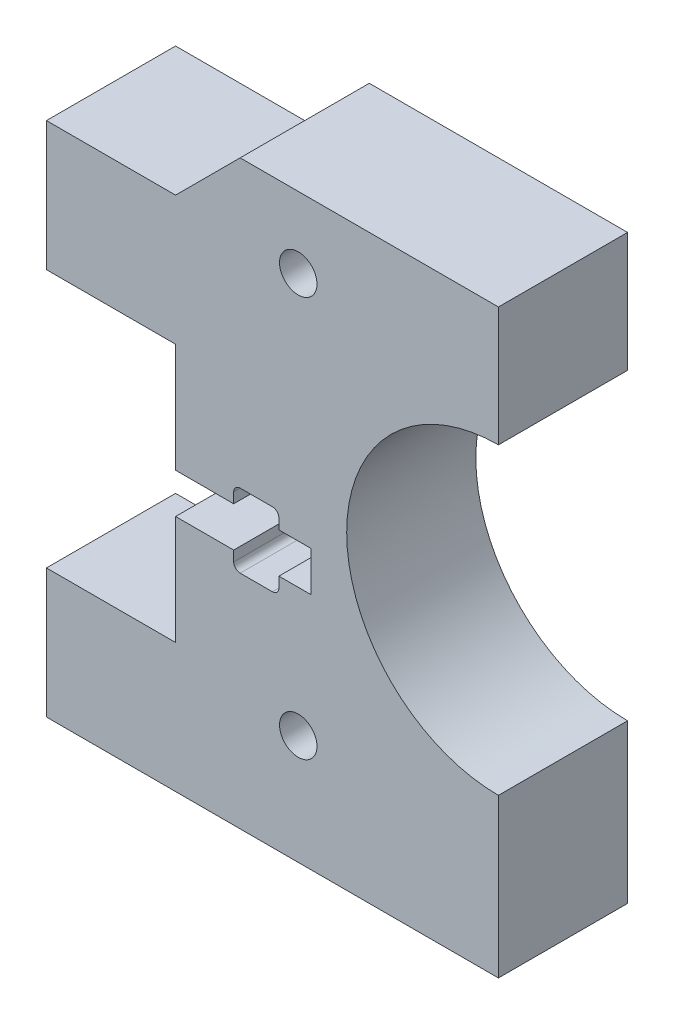
from build123d import *

# Parameters (mm, degrees)
BOSS_EXTRUDE1_DEPTH = 10
SKETCH2_R           = 11.75
SKETCH2_R_2         = 1.45
MOTOR_DEPTH         = 57.789083458
SCREW_DEPTH         = 57.789083458
SKETCH4_W           = 25
SKETCH4_H           = 5
CUT_EXTRUDE3_DEPTH  = 57.789083458


with BuildPart() as part:
    # Sketch1 → Boss-Extrude1 (new body)
    with BuildSketch(Plane.XY):
        Polygon((0, 0), (0, -5), (-10, -5), (-10, -15), (0, -15), (0, -35), (-10, -35), (-10, -45), (0, -45), (0, -50), (25, -50), (25, 0), align=None)
    extrude(amount=BOSS_EXTRUDE1_DEPTH)

    # Sketch2 → motor (cut, through all)
    with BuildSketch(Plane.XY.offset(10)):
        with Locations((25, -21)):
            Circle(SKETCH2_R)
        with Locations((9.5, -5.5)):
            Circle(SKETCH2_R_2)
        with Locations(Location((9.5, -36.5, 0), (0, 0, 180))):
            Circle(SKETCH2_R_2)
    extrude(amount=-MOTOR_DEPTH, mode=Mode.SUBTRACT)

    # Sketch3 → screw (cut, through all)
    with BuildSketch(Plane.XY.offset(10)):
        with BuildLine():
            Line((0, -26.55), (0, -23.45))
            Line((0, -23.45), (4.5, -23.45))
            Line((4.5, -23.45), (4.5, -22.65))
            ThreePointArc((4.5, -22.65), (4.646446609, -22.296446609), (5, -22.15))
            Line((5, -22.15), (7.5, -22.15))
            ThreePointArc((7.5, -22.15), (7.853553391, -22.296446609), (8, -22.65))
            Line((8, -22.65), (8, -23.45))
            Line((8, -23.45), (10.5, -23.45))
            Line((10.5, -23.45), (10.5, -26.55))
            Line((10.5, -26.55), (8, -26.55))
            Line((8, -26.55), (8, -27.35))
            ThreePointArc((8, -27.35), (7.853553391, -27.703553391), (7.5, -27.85))
            Line((7.5, -27.85), (5, -27.85))
            ThreePointArc((5, -27.85), (4.646446609, -27.703553391), (4.5, -27.35))
            Line((4.5, -27.35), (4.5, -26.55))
            Line((4.5, -26.55), (0, -26.55))
        make_face()
    extrude(amount=-SCREW_DEPTH, mode=Mode.SUBTRACT)

    # Sketch4 → Cut-Extrude3 (cut, through all)
    with BuildSketch(Plane.XY.offset(10)):
        with Locations((12.5, -47.5)):
            Rectangle(SKETCH4_W, SKETCH4_H)
        Polygon((0, -5), (5, 0), (0, 0), align=None)
    extrude(amount=-CUT_EXTRUDE3_DEPTH, mode=Mode.SUBTRACT)


solid = part.part
